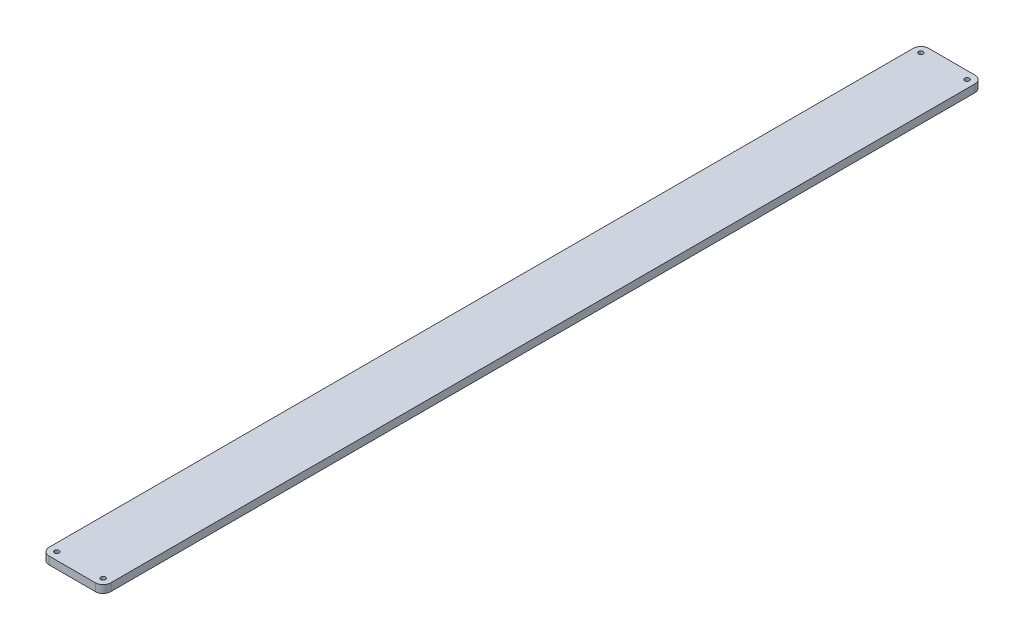
from build123d import *

# Parameters (mm, degrees)
SKETCH_1_W      = 40
SKETCH_1_H      = 571
SKETCH_1_R      = 1.5
EXTRUDE_1_DEPTH = 5
FILLET_1_R      = 5


with BuildPart() as part:
    # ｽｹｯﾁ1 → ﾎﾞｽ - 押し出し1 (new body)
    with BuildSketch(Plane(origin=(0, 0, 0), x_dir=(1, 0, 0), z_dir=(0, 1, 0))):
        Rectangle(SKETCH_1_W, SKETCH_1_H)
        with Locations(Location((15, 280.5, 0), (0, 0, 270))):
            Circle(SKETCH_1_R, mode=Mode.SUBTRACT)
        with Locations(Location((-15, 280.5, 0), (0, 0, 90))):
            Circle(SKETCH_1_R, mode=Mode.SUBTRACT)
        with Locations(Location((-15, -280.5, 0), (0, 0, 270))):
            Circle(SKETCH_1_R, mode=Mode.SUBTRACT)
        with Locations(Location((15, -280.5, 0), (0, 0, 90))):
            Circle(SKETCH_1_R, mode=Mode.SUBTRACT)
    extrude(amount=EXTRUDE_1_DEPTH)

    # ﾌｨﾚｯﾄ1
    fillet_1_edges = [part.edges().sort_by_distance(p)[0] for p in [
        (20, 2.5, 285.5),
        (-20, 2.5, 285.5),
        (-20, 2.5, -285.5),
        (20, 2.5, -285.5),
    ]]
    fillet(fillet_1_edges, radius=FILLET_1_R)


solid = part.part
